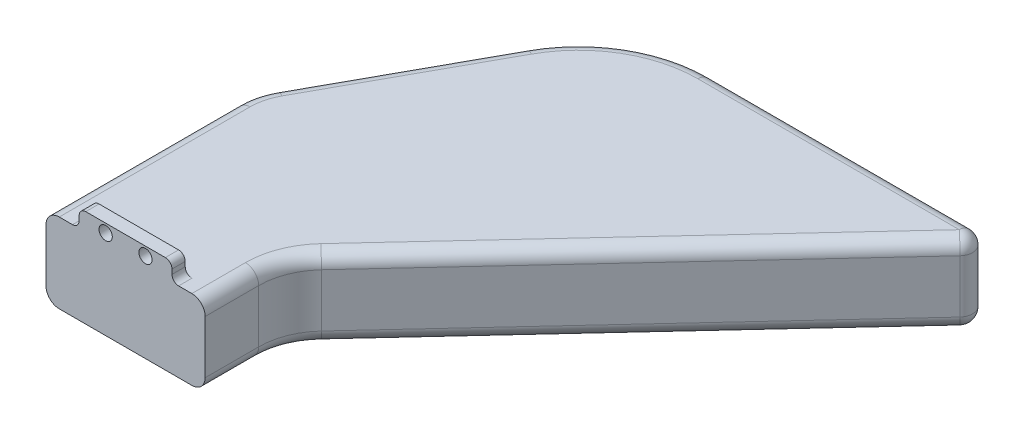
from build123d import *

# Parameters (mm, degrees)
BOSS_EXTRUDE1_DEPTH = 6
FILLET1_R           = 1
FILLET2_R           = 1
SKETCH3_W           = 7
SKETCH3_H           = 1.35
BOSS_EXTRUDE2_DEPTH = 1
FILLET4_R           = 0.5
SKETCH4_R           = 0.5
CUT_EXTRUDE1_DEPTH  = 1


with BuildPart() as part:
    # Sketch1 → Boss-Extrude1 (new body)
    with BuildSketch(Plane(origin=(0, 0, 0), x_dir=(1, 0, 0), z_dir=(0, 1, 0))):
        with BuildLine():
            Line((-11.381708203, 10.791631839), (-4.712422066, 22.925104071))
            ThreePointArc((-4.712422066, 22.925104071), (-1.039732152, 26.715438863), (4.050994341, 28.108203315))
            Line((4.050994341, 28.108203315), (23.765326904, 28.108203315))
            ThreePointArc((23.765326904, 28.108203315), (24.68179457, 27.508312073), (24.498700382, 26.428377351))
            Line((24.498700382, 26.428377351), (1.333132609, 1.438138803))
            ThreePointArc((1.333132609, 1.438138803), (0.345199416, -0.135386591), (0, -1.960991017))
            Line((0, -1.960991017), (0, -6))
            Line((0, -6), (-12, -6))
            Line((-12, -6), (-12, 8.383181461))
            ThreePointArc((-12, 8.383181461), (-11.842960924, 9.626455161), (-11.381708203, 10.791631839))
        make_face()
    extrude(amount=BOSS_EXTRUDE1_DEPTH)

    # Fillet1
    fillet1_edges = [part.edges().sort_by_distance(p)[0] for p in [
        (-11.842960924, 6, -9.626455161),
        (-12, 6, -1.191590731),
        (0, 6, 3.980495509),
        (0.345199416, 6, 0.135386591),
        (12.915916496, 6, -13.933258077),
        (24.68179457, 6, -27.508312073),
        (13.908160623, 6, -28.108203315),
        (-1.039732152, 6, -26.715438863),
        (-8.047065134, 6, -16.858367955),
    ]]
    fillet(fillet1_edges, radius=FILLET1_R)

    # Fillet2
    fillet2_edges = [part.edges().sort_by_distance(p)[0] for p in [
        (12.915916496, 0, -13.933258077),
        (0.345199416, 0, 0.135386591),
        (0, 0, 3.980495509),
        (-12, 0, -1.191590731),
        (-11.842960924, 0, -9.626455161),
        (-8.047065134, 0, -16.858367955),
        (-1.039732152, 0, -26.715438863),
        (13.908160623, 0, -28.108203315),
        (24.68179457, 0, -27.508312073),
    ]]
    fillet(fillet2_edges, radius=FILLET2_R)

    # Sketch3 → Boss-Extrude2 (add)
    with BuildSketch(Plane.XY.offset(6)):
        with Locations((-6, 6.675)):
            Rectangle(SKETCH3_W, SKETCH3_H)
    extrude(amount=-BOSS_EXTRUDE2_DEPTH)

    # Fillet4
    fillet4_edges = [part.edges().sort_by_distance(p)[0] for p in [
        (-2.5, 6, 5.5),
        (-9.5, 6, 5.5),
        (-9.5, 7.35, 5.5),
        (-2.5, 7.35, 5.5),
    ]]
    fillet(fillet4_edges, radius=FILLET4_R)

    # Sketch4 → Cut-Extrude1 (cut)
    with BuildSketch(Plane(origin=(0, 0, 5), x_dir=(-1, 0, 0), z_dir=(0, 0, -1))):
        with Locations((7.5, 6.7)):
            Circle(SKETCH4_R)
        with Locations(Location((4.5, 6.7, 0), (0, 0, 180))):
            Circle(SKETCH4_R)
    extrude(amount=-CUT_EXTRUDE1_DEPTH, mode=Mode.SUBTRACT)


solid = part.part
